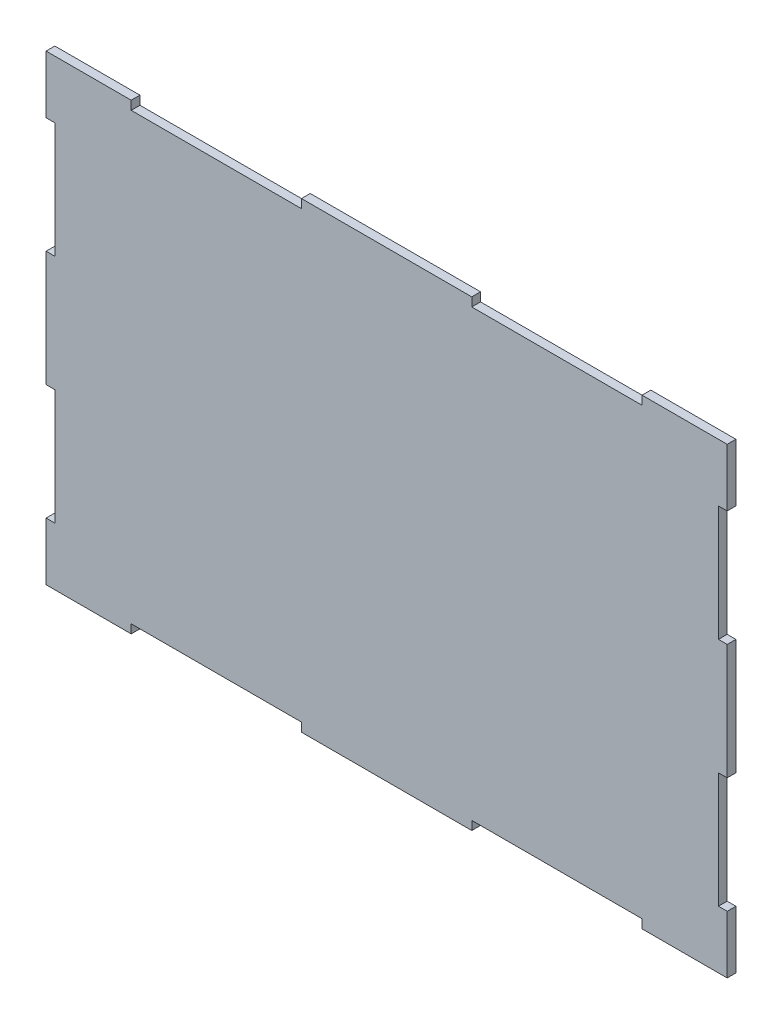
from build123d import *

# Parameters (mm, degrees)
EXTRUDE_1_DEPTH = 3.6


with BuildPart() as part:
    # 草图1 → 凸台-拉伸1 (new body)
    with BuildSketch(Plane.XY):
        Polygon((140, 95), (105, 95), (105, 91.4), (35, 91.4), (35, 95), (-35, 95), (-35, 91.4), (-105, 91.4), (-105, 95), (-140, 95), (-140, 71.25), (-136.4, 71.25), (-136.4, 23.75), (-140, 23.75), (-140, -23.75), (-136.4, -23.75), (-136.4, -71.25), (-140, -71.25), (-140, -95), (-105, -95), (-105, -91.4), (-35, -91.4), (-35, -95), (35, -95), (35, -91.4), (105, -91.4), (105, -95), (140, -95), (140, -71.25), (136.4, -71.25), (136.4, -23.75), (140, -23.75), (140, 23.75), (136.4, 23.75), (136.4, 71.25), (140, 71.25), align=None)
    extrude(amount=EXTRUDE_1_DEPTH)


solid = part.part
